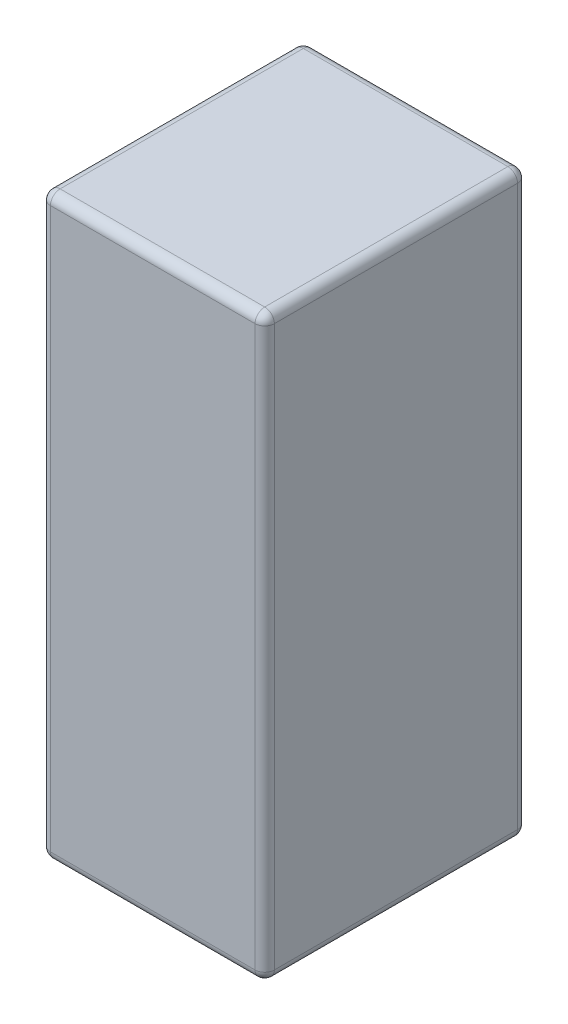
from build123d import *

# Parameters (mm, degrees)
SKETCH2_W           = 29
SKETCH2_H           = 34
BOSS_EXTRUDE1_DEPTH = 75
FILLET1_R           = 1.25


with BuildPart() as part:
    # Sketch2 → Boss-Extrude1 (new body)
    with BuildSketch(Plane(origin=(0, 0, 0), x_dir=(1, 0, 0), z_dir=(0, 1, 0))):
        Rectangle(SKETCH2_W, SKETCH2_H)
    extrude(amount=BOSS_EXTRUDE1_DEPTH)

    # Fillet1
    fillet1_edges = [part.edges().sort_by_distance(p)[0] for p in [
        (-14.5, 75, 0),
        (0, 75, 17),
        (14.5, 75, 0),
        (0, 0, 17),
        (-14.5, 0, 0),
        (0, 0, -17),
        (14.5, 0, 0),
        (14.5, 37.5, 17),
        (-14.5, 37.5, 17),
        (-14.5, 37.5, -17),
        (14.5, 37.5, -17),
        (0, 75, -17),
    ]]
    fillet(fillet1_edges, radius=FILLET1_R)


solid = part.part
